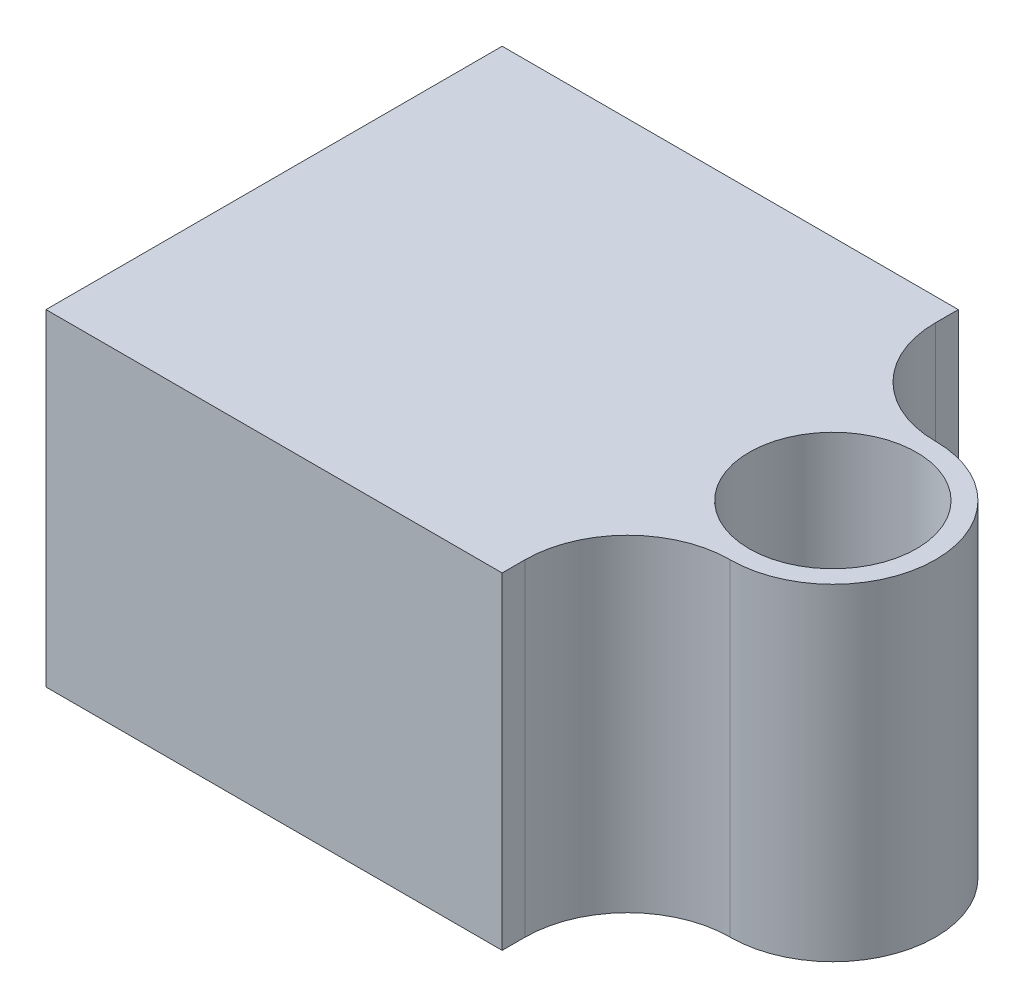
from build123d import *

# Parameters (mm, degrees)
SKETCH_1_R      = 11
EXTRUDE_1_DEPTH = 21.5


with BuildPart() as part:
    # Эскиз1 → Бобышка-Вытянуть1 (new, symmetric)
    with BuildSketch(Plane(origin=(0, 0, 0), x_dir=(1, 0, 0), z_dir=(0, 1, 0))):
        with BuildLine():
            ThreePointArc((0, 13.5), (-9.545941546, 17.454058454), (-13.5, 27))
            Line((-13.5, 27), (-13.5, 30))
            Line((-13.5, 30), (-73.5, 30))
            Line((-73.5, 30), (-73.5, -30))
            Line((-73.5, -30), (-13.5, -30))
            Line((-13.5, -30), (-13.5, -27))
            ThreePointArc((-13.5, -27), (-9.545941546, -17.454058454), (0, -13.5))
            ThreePointArc((0, -13.5), (9.545941546, -9.545941546), (13.5, 0))
            ThreePointArc((13.5, 0), (9.545941546, 9.545941546), (0, 13.5))
        make_face()
        with Locations(Location((0, 0, 0), (0, 0, 270))):
            Circle(SKETCH_1_R, mode=Mode.SUBTRACT)
    extrude(amount=EXTRUDE_1_DEPTH, both=True)


solid = part.part
